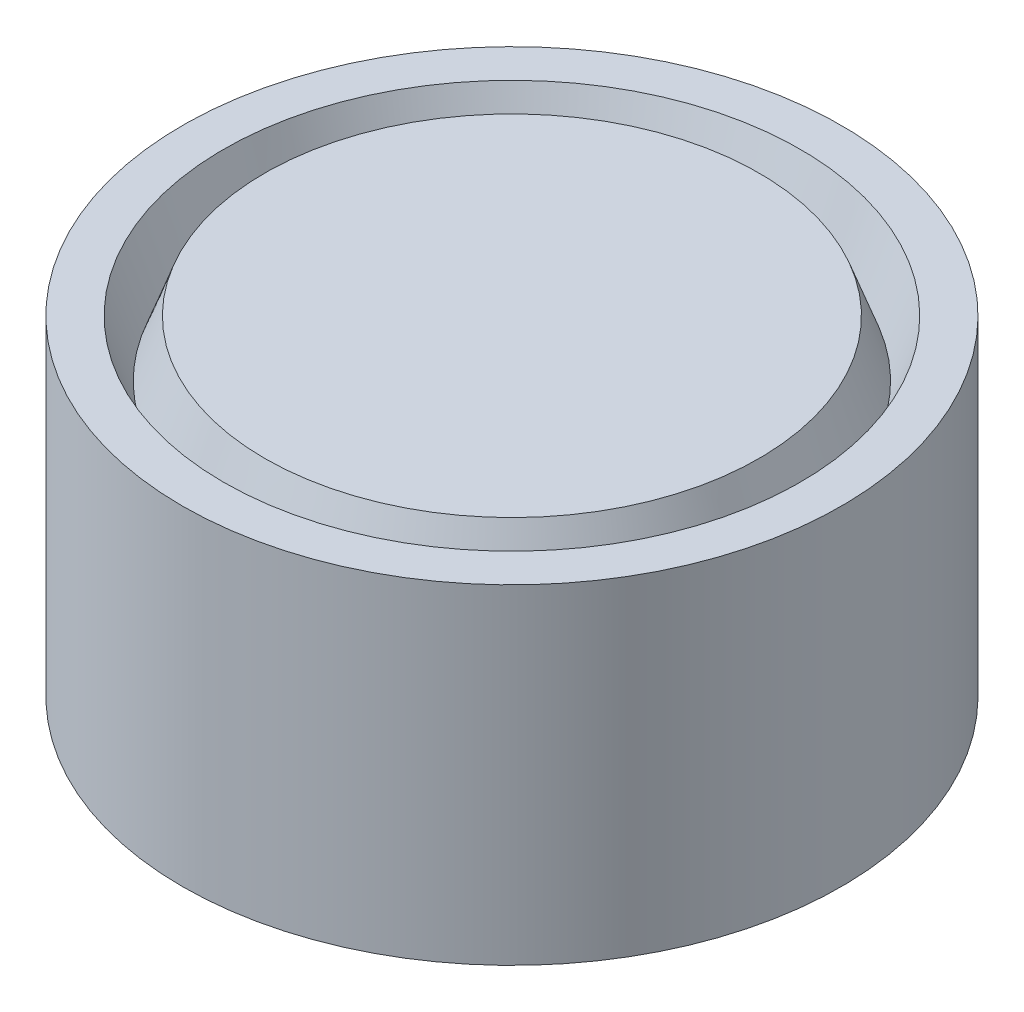
from build123d import *

# Parameters (mm, degrees)
SKETCH1_R           = 20
BOSS_EXTRUDE1_DEPTH = 20
SKETCH2_R           = 17.5
SKETCH2_R_2         = 15
CUT_EXTRUDE1_DEPTH  = 10
CUT_EXTRUDE1_TAPER  = 20
SKETCH3_R           = 2
CUT_EXTRUDE2_DEPTH  = 5


with BuildPart() as part:
    # Sketch1 → Boss-Extrude1 (new body)
    with BuildSketch(Plane(origin=(0, 0, 0), x_dir=(1, 0, 0), z_dir=(0, 1, 0))):
        with Locations(Location((0, 0, 0), (0, 0, 270))):
            Circle(SKETCH1_R)
    extrude(amount=BOSS_EXTRUDE1_DEPTH)

    # Sketch2 → Cut-Extrude1 (cut)
    with BuildSketch(Plane(origin=(0, 20, 0), x_dir=(1, 0, 0), z_dir=(0, 1, 0))):
        Circle(SKETCH2_R)
        Circle(SKETCH2_R_2, mode=Mode.SUBTRACT)
    extrude(amount=-CUT_EXTRUDE1_DEPTH, taper=CUT_EXTRUDE1_TAPER, mode=Mode.SUBTRACT)

    # Sketch3 → Cut-Extrude2 (cut)
    with BuildSketch(Plane.XZ):
        with Locations(Location((0, 0, 0), (0, 0, 270))):
            Circle(SKETCH3_R)
    extrude(amount=-CUT_EXTRUDE2_DEPTH, mode=Mode.SUBTRACT)


solid = part.part
